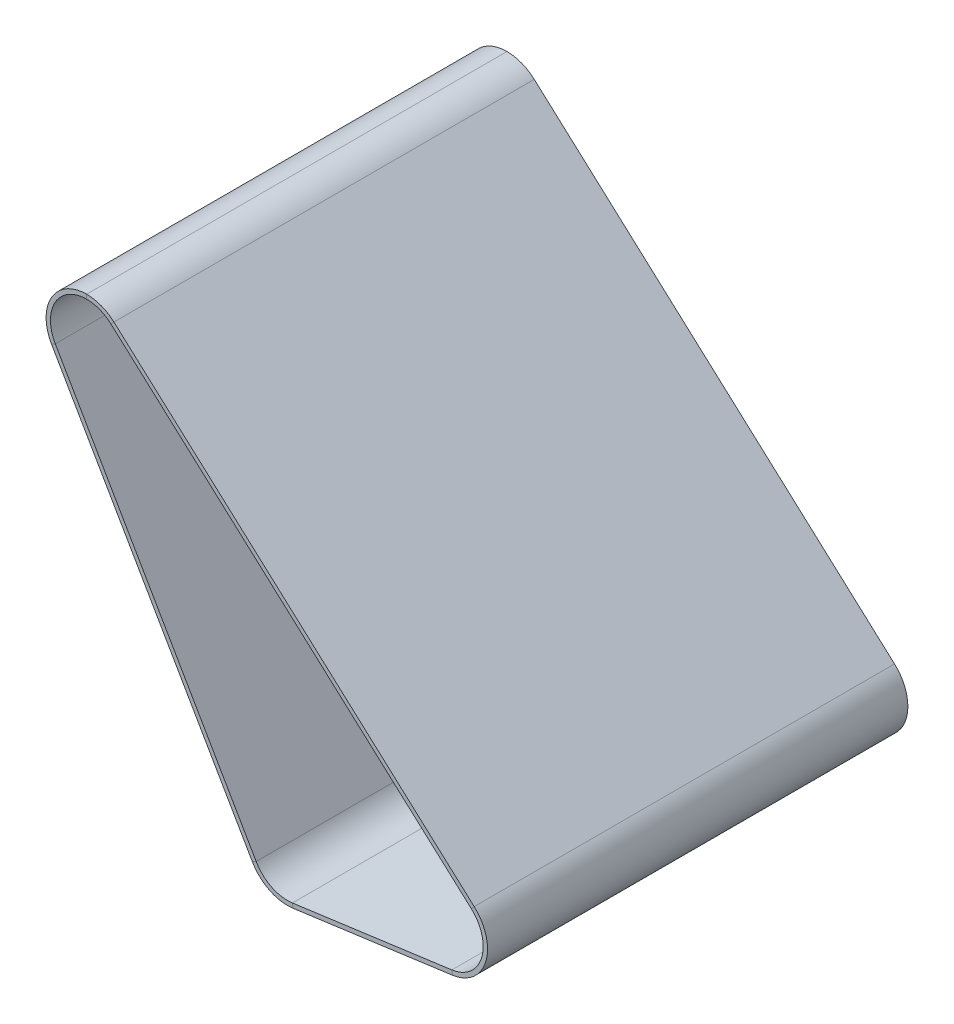
from build123d import *

# Parameters (mm, degrees)
ESQUISSE3_W = 290
ESQUISSE3_H = 3


with BuildPart() as part:
    # Balayage1: sweep along a path in Esquisse2
    with BuildLine(Plane.XY) as balayage1_path:
        Line((-21.650635095, -12.5), (116.913429511, -252.5))
        ThreePointArc((116.913429511, -252.5), (127.558761221, -262.447344997), (141.941894724, -264.770754201))
        Line((141.941894724, -264.770754201), (251.941894724, -249.770754201))
        ThreePointArc((251.941894724, -249.770754201), (272.446913518, -232.389825968), (265.341354263, -206.465638621))
        Line((265.341354263, -206.465638621), (16.777289658, 18.534361379))
        ThreePointArc((16.777289658, 18.534361379), (-15.707331743, 19.449414631), (-21.650635095, -12.5))
    # Esquisse3 → Balayage1 (sweep)
    with BuildSketch(Plane(origin=(0, 0, 0), x_dir=(0, 0, -1), z_dir=(1, 0, 0))):
        with Locations((0, 26.5)):
            Rectangle(ESQUISSE3_W, ESQUISSE3_H)
    sweep(path=balayage1_path.line)


solid = part.part
